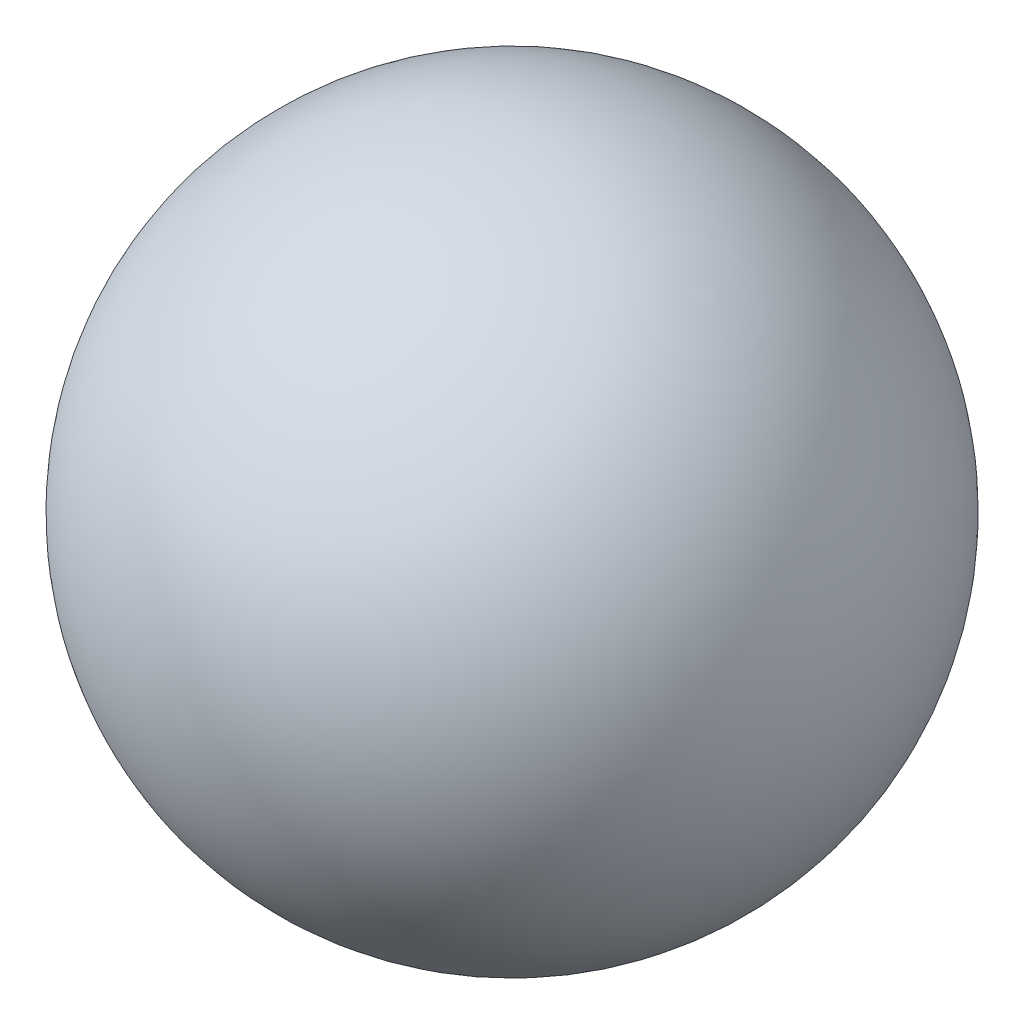
from build123d import *


with BuildPart() as part:
    # Sketch1 → Revolve2 (revolve)
    with BuildSketch(Plane(origin=(0, 0, 0), x_dir=(1, 0, 0), z_dir=(0, 1, 0))):
        with BuildLine():
            Line((0, -11.43), (0, 11.43))
            ThreePointArc((0, 11.43), (11.43, 0), (0, -11.43))
        make_face()
    revolve(axis=Axis((0, 0, 11.43), (0, 0, -1)))


solid = part.part
